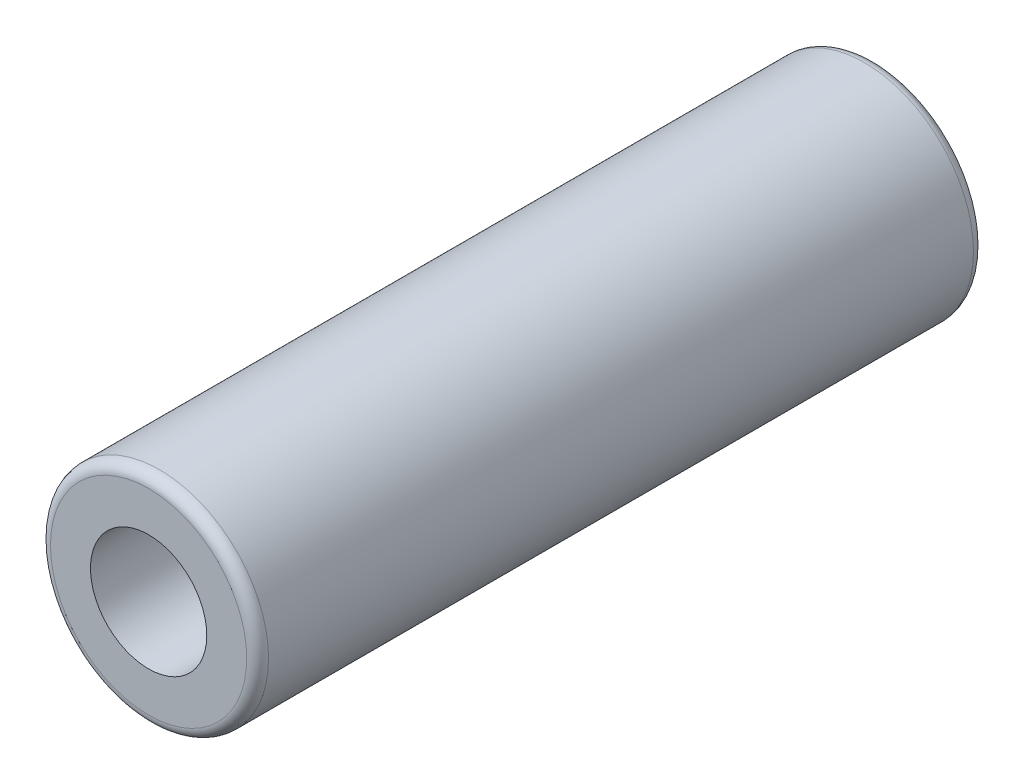
from build123d import *

# Parameters (mm, degrees)
SKETCH1_R           = 3
SKETCH1_R_2         = 1.6
BOSS_EXTRUDE1_DEPTH = 20
FILLET1_R           = 0.3


with BuildPart() as part:
    # Sketch1 → Boss-Extrude1 (new body)
    with BuildSketch(Plane.XY):
        Circle(SKETCH1_R)
        Circle(SKETCH1_R_2, mode=Mode.SUBTRACT)
    extrude(amount=BOSS_EXTRUDE1_DEPTH)

    # Fillet1
    fillet1_edges = [part.edges().sort_by_distance(p)[0] for p in [
        (-3, 0, 0),
        (-3, 0, 20),
    ]]
    fillet(fillet1_edges, radius=FILLET1_R)


solid = part.part
